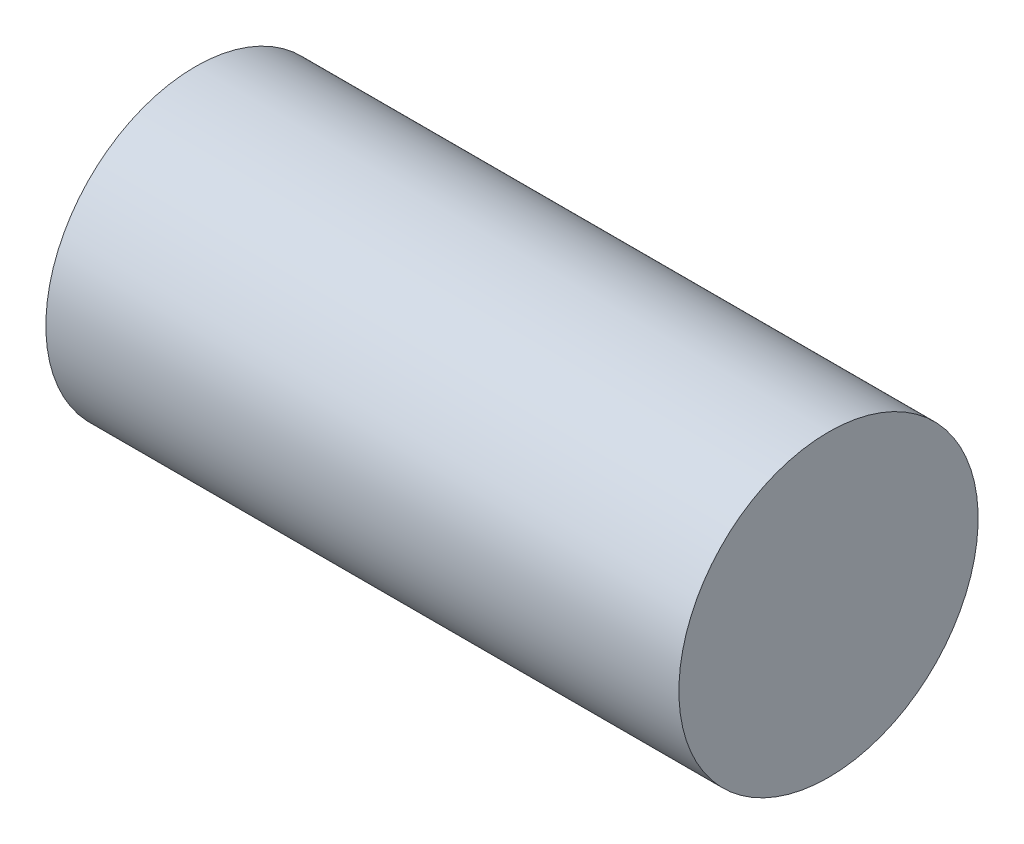
from build123d import *

# Parameters (mm, degrees)
SKETCH1_W = 550
SKETCH1_H = 130


with BuildPart() as part:
    # Sketch1 → Revolve1 (revolve)
    with BuildSketch(Plane.XY):
        with Locations((275, 65)):
            Rectangle(SKETCH1_W, SKETCH1_H)
    revolve(axis=Axis((550, 0, 0), (-1, 0, 0)))


solid = part.part
